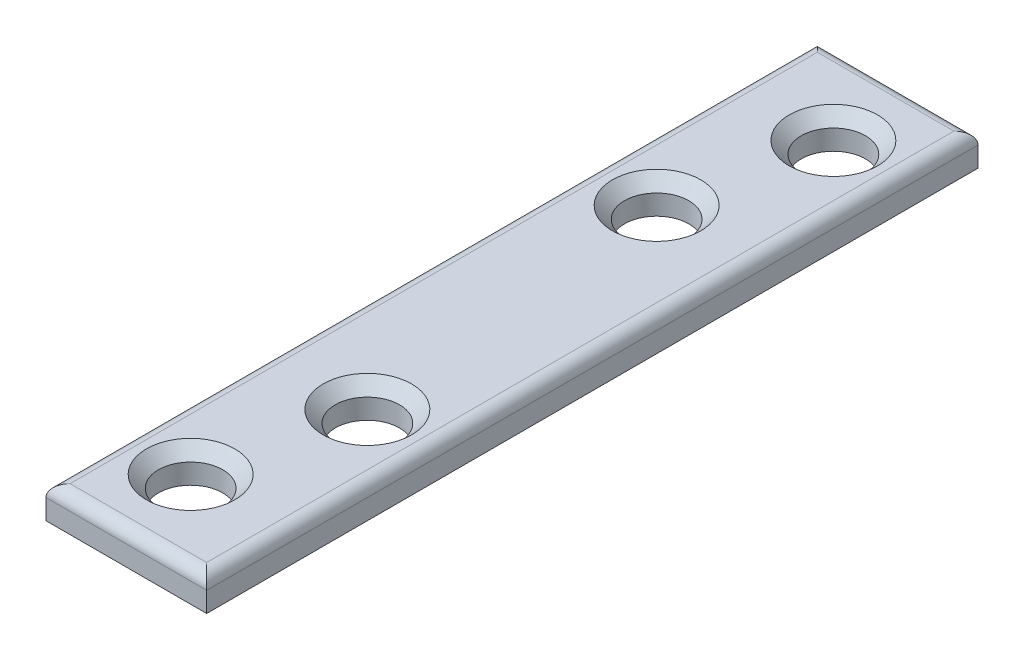
from build123d import *

# Parameters (mm, degrees)
SKETCH1_W           = 15.875
SKETCH1_H           = 76.2
BOSS_EXTRUDE1_DEPTH = 3.175
SKETCH2_R           = 3.175
CUT_EXTRUDE1_DEPTH  = 78.90081033
CHAMFER1_SIZE       = 1.190625
FILLET1_R           = 1.190625


with BuildPart() as part:
    # Sketch1 → Boss-Extrude1 (new body)
    with BuildSketch(Plane(origin=(0, 0, 0), x_dir=(1, 0, 0), z_dir=(0, 1, 0))):
        with Locations((7.9375, 38.1)):
            Rectangle(SKETCH1_W, SKETCH1_H)
    extrude(amount=BOSS_EXTRUDE1_DEPTH)

    # Sketch2 → Cut-Extrude1 (cut, through all)
    with BuildSketch(Plane(origin=(0, 3.175, 0), x_dir=(1, 0, 0), z_dir=(0, 1, 0))):
        with Locations(Location((6.35, 53.975, 0), (0, 0, 270))):
            Circle(SKETCH2_R)
        with Locations(Location((9.525, 68.2625, 0), (0, 0, 270))):
            Circle(SKETCH2_R)
        with Locations(Location((9.525, 22.225, 0), (0, 0, 270))):
            Circle(SKETCH2_R)
        with Locations(Location((6.35, 7.9375, 0), (0, 0, 270))):
            Circle(SKETCH2_R)
    extrude(amount=-CUT_EXTRUDE1_DEPTH, mode=Mode.SUBTRACT)

    # Chamfer1
    chamfer1_edges = [part.edges().sort_by_distance(p)[0] for p in [
        (6.35, 3.175, -57.15),
        (9.525, 3.175, -71.4375),
        (9.525, 3.175, -25.4),
        (6.35, 3.175, -11.1125),
    ]]
    chamfer(chamfer1_edges, length=CHAMFER1_SIZE)

    # Fillet1
    fillet1_edges = [part.edges().sort_by_distance(p)[0] for p in [
        (15.875, 3.175, -38.1),
        (7.9375, 3.175, -76.2),
        (0, 3.175, -38.1),
        (7.9375, 3.175, 0),
    ]]
    fillet(fillet1_edges, radius=FILLET1_R)


solid = part.part
